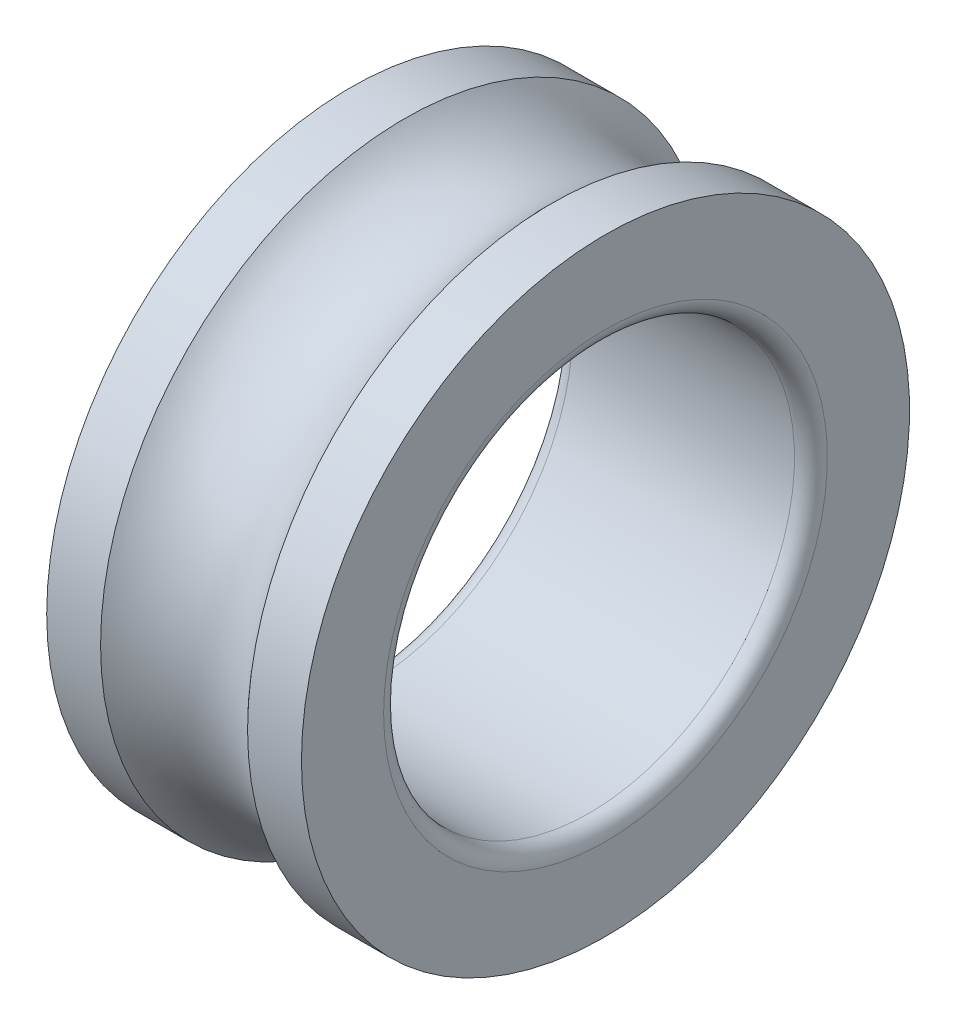
from build123d import *

# Parameters (mm, degrees)
FILLET_1_R = 2


with BuildPart() as part:
    # 草图1 → 旋转1 (revolve)
    with BuildSketch(Plane.XY, mode=Mode.PRIVATE) as revolve_1_sk:
        with BuildLine():
            Line((8.94427191, 37), (15.5, 37))
            Line((15.5, 37), (15.5, 25))
            Line((15.5, 25), (-15.5, 25))
            Line((-15.5, 25), (-15.5, 37))
            Line((-15.5, 37), (-8.94427191, 37))
            ThreePointArc((-8.94427191, 37), (0, 33), (8.94427191, 37))
        make_face()
    revolve(revolve_1_sk.sketch.rotate(Axis((0, 0, 0), (1, 0, 0)), 90), axis=Axis((0, 0, 0), (1, 0, 0)))

    # 圆角1
    fillet_1_edges = [part.edges().sort_by_distance(p)[0] for p in [
        (15.5, 0, -25),
        (-15.5, 0, -25),
    ]]
    fillet(fillet_1_edges, radius=FILLET_1_R)


solid = part.part
